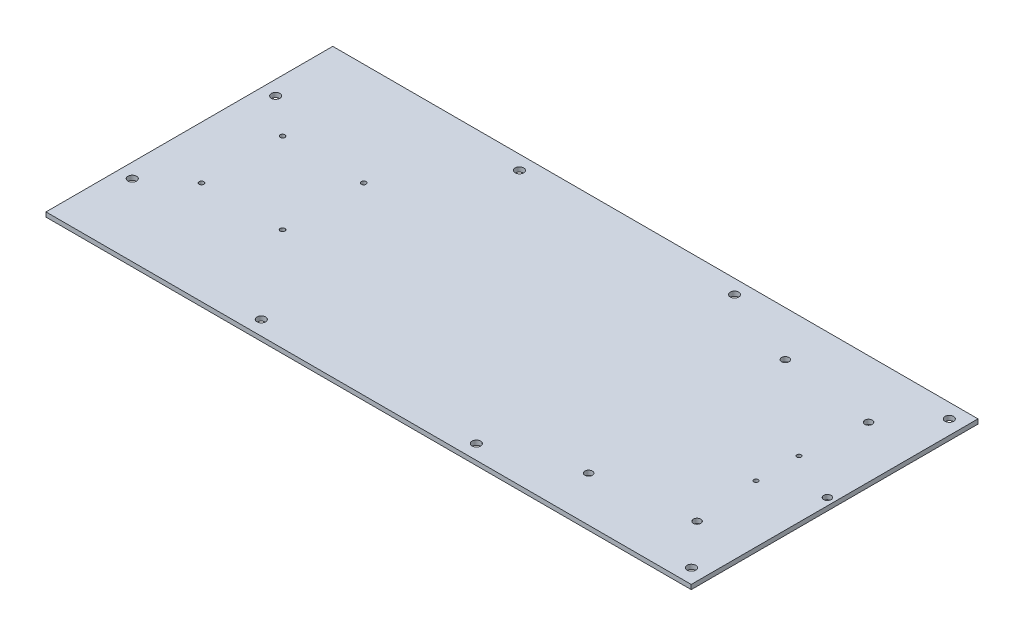
from build123d import *

# Parameters (mm, degrees)
SKETCH1_R           = 1.5
SKETCH1_R_2         = 3
SKETCH1_R_3         = 2.6
SKETCH1_R_4         = 1.65
BOSS_EXTRUDE1_DEPTH = 3.175


with BuildPart() as part:
    # Sketch1 → Boss-Extrude1 (new body)
    with BuildSketch(Plane(origin=(0, 0, 0), x_dir=(1, 0, 0), z_dir=(0, 1, 0))):
        Polygon((64.838003204, 110.310049741), (444.838003204, 110.310049741), (444.838003204, 310.310049741), (69.838003204, 310.310049741), (-5.161996796, 310.310049741), (-5.161996796, 110.310049741), align=None)
        with Locations(Location((404.838003204, 225.468098835, 0), (0, 0, 270))):
            Circle(SKETCH1_R, mode=Mode.SUBTRACT)
        with Locations(Location((404.838003204, 195.468098835, 0), (0, 0, 270))):
            Circle(SKETCH1_R, mode=Mode.SUBTRACT)
        with Locations(Location((4.838003204, 260.468098835, 0), (0, 0, 270))):
            Circle(SKETCH1_R_2, mode=Mode.SUBTRACT)
        with Locations(Location((434.838003204, 300.310049741, 0), (0, 0, 270))):
            Circle(SKETCH1_R_2, mode=Mode.SUBTRACT)
        with Locations(Location((134.838003204, 300.468098835, 0), (0, 0, 270))):
            Circle(SKETCH1_R_2, mode=Mode.SUBTRACT)
        with Locations(Location((284.83809231, 300.473548709, 0), (0, 0, 270))):
            Circle(SKETCH1_R_2, mode=Mode.SUBTRACT)
        with Locations(Location((434.838003204, 120.468098835, 0), (0, 0, 90))):
            Circle(SKETCH1_R_2, mode=Mode.SUBTRACT)
        with Locations(Location((284.838003204, 120.468098835, 0), (0, 0, 90))):
            Circle(SKETCH1_R_2, mode=Mode.SUBTRACT)
        with Locations(Location((134.838003204, 120.468098835, 0), (0, 0, 90))):
            Circle(SKETCH1_R_2, mode=Mode.SUBTRACT)
        with Locations(Location((4.838003204, 160.468098835, 0), (0, 0, 90))):
            Circle(SKETCH1_R_2, mode=Mode.SUBTRACT)
        with Locations(Location((439.840442188, 210.310049741, 0), (0, 0, 270))):
            Circle(SKETCH1_R_3, mode=Mode.SUBTRACT)
        with Locations(Location((408.71152183, 150.511950619, 0), (0, 0, 270))):
            Circle(SKETCH1_R_3, mode=Mode.SUBTRACT)
        with Locations(Location((341.872971694, 141.712488661, 0), (0, 0, 270))):
            Circle(SKETCH1_R_3, mode=Mode.SUBTRACT)
        with Locations(Location((408.711522042, 270.108148975, 0), (0, 0, 270))):
            Circle(SKETCH1_R_3, mode=Mode.SUBTRACT)
        with Locations(Location((341.872971726, 278.907611059, 0), (0, 0, 270))):
            Circle(SKETCH1_R_3, mode=Mode.SUBTRACT)
        with Locations(Location((31.553731956, 238.594320989, 0), (0, 0, 270))):
            Circle(SKETCH1_R_4, mode=Mode.SUBTRACT)
        with Locations(Location((88.122274451, 238.594320989, 0), (0, 0, 270))):
            Circle(SKETCH1_R_4, mode=Mode.SUBTRACT)
        with Locations(Location((88.122274451, 182.025778494, 0), (0, 0, 270))):
            Circle(SKETCH1_R_4, mode=Mode.SUBTRACT)
        with Locations(Location((31.553731956, 182.025778494, 0), (0, 0, 270))):
            Circle(SKETCH1_R_4, mode=Mode.SUBTRACT)
    extrude(amount=BOSS_EXTRUDE1_DEPTH)


solid = part.part
